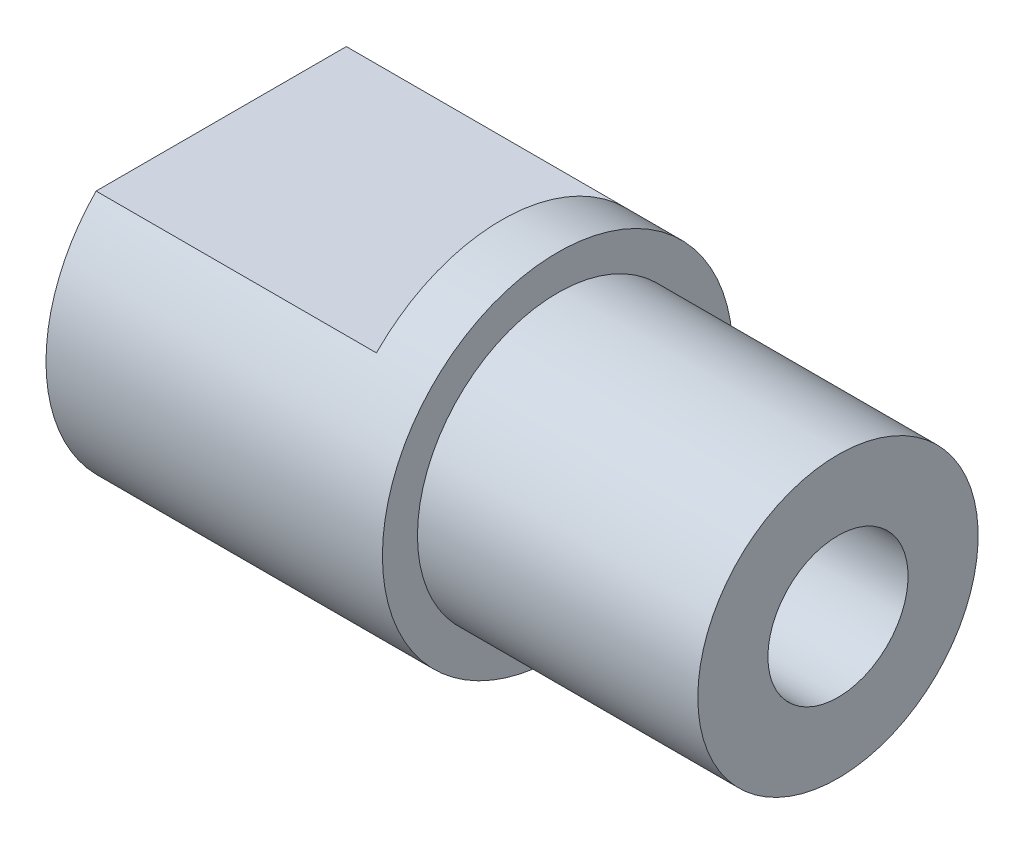
from build123d import *

# Parameters (mm, degrees)
CUT_EXTRUDE2_START = -12.7
CUT_EXTRUDE2_DEPTH = 12.7


with BuildPart() as part:
    # Sketch1 → Revolve1 (revolve)
    with BuildSketch(Plane.XY, mode=Mode.PRIVATE) as revolve1_sk:
        Polygon((0, 3.175), (0, 7.9375), (15.24, 7.9375), (15.24, 6.35), (27.94, 6.35), (27.94, 3.175), align=None)
    revolve(revolve1_sk.sketch.rotate(Axis((0, 0, 0), (1, 0, 0)), 90), axis=Axis((0, 0, 0), (1, 0, 0)))

    # Sketch2 → Cut-Extrude2 (cut)
    with BuildSketch(Plane.ZY.offset(CUT_EXTRUDE2_START)):
        with BuildLine():
            Line((-5.668508815, 5.55625), (5.668508815, 5.55625))
            ThreePointArc((5.668508815, 5.55625), (0, 7.9375), (-5.668508815, 5.55625))
        make_face()
        with BuildLine():
            Line((-5.668508815, -5.55625), (5.668508815, -5.55625))
            ThreePointArc((5.668508815, -5.55625), (0, -7.9375), (-5.668508815, -5.55625))
        make_face()
    extrude(amount=CUT_EXTRUDE2_DEPTH, mode=Mode.SUBTRACT)


solid = part.part
